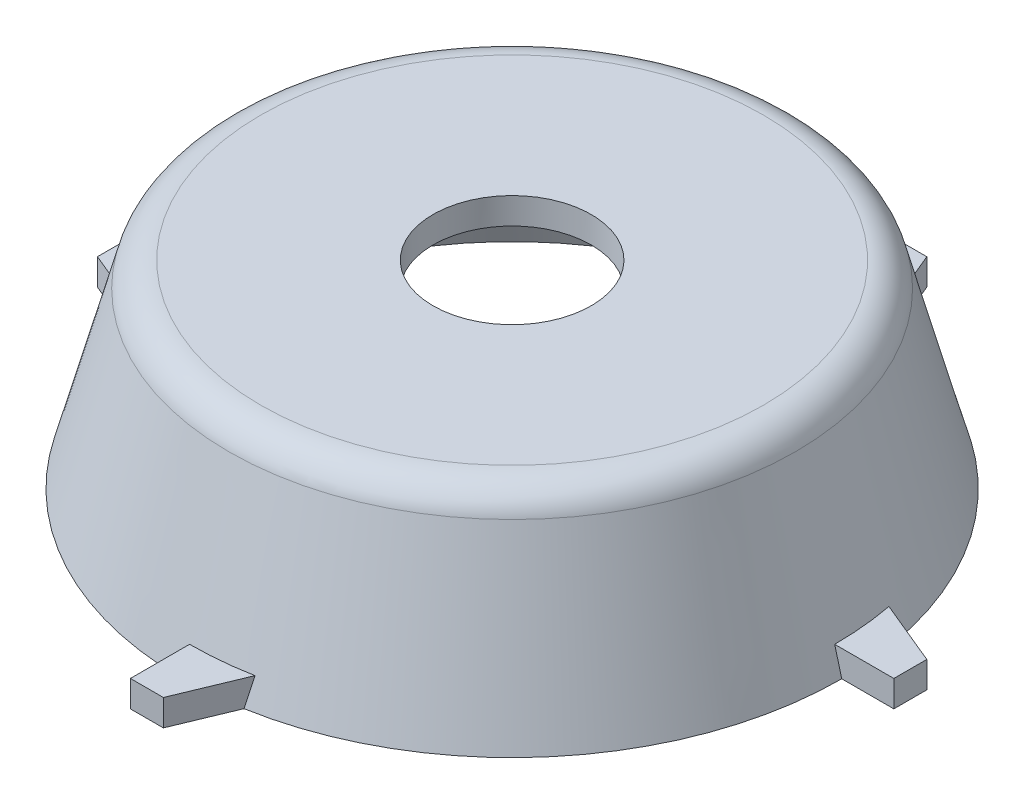
from build123d import *

# Parameters (mm, degrees)
CROQUIS3_W              = 50
CROQUIS3_H              = 30
VACIADO1_T              = -4
CORTAR_EXTRUIR1_REACH   = 78.811
CROQUIS7_R              = 12
REDONDEO1_R             = 5
SALIENTE_EXTRUIR1_DEPTH = 4
MATRIZC10_COUNT         = 4


with BuildPart() as part:
    # Croquis3 → Revolución1 (revolve)
    with BuildSketch(Plane(origin=(0, 0, 0), x_dir=(0, 0, -1), z_dir=(1, 0, 0)), mode=Mode.PRIVATE) as revoluci_n1_sk:
        with Locations((-25, 15)):
            Rectangle(CROQUIS3_W, CROQUIS3_H)
    revolve(revoluci_n1_sk.sketch.rotate(Axis((0, 0, 0), (0, 1, 0)), 180), axis=Axis((0, 0, 0), (0, 1, 0)))

    # Croquis6 → Cortar-Revolución1 (revolve, cut)
    with BuildSketch(Plane.XY, mode=Mode.PRIVATE) as cortar_revoluci_n1_sk:
        Polygon((-50, 30), (-50, 0), (-41.961524227, 30), align=None)
    revolve(cortar_revoluci_n1_sk.sketch.rotate(Axis((0, -970, 0), (0, 1, 0)), 180), axis=Axis((0, -970, 0), (0, 1, 0)), mode=Mode.SUBTRACT)

    # Vaciado1
    vaciado1_openings = [part.faces().sort_by_distance(p)[0] for p in [
        (0, 0, 0),
    ]]
    offset(amount=VACIADO1_T, openings=vaciado1_openings, kind=Kind.INTERSECTION)

    # Croquis7 → Cortar-Extruir1 (cut, up to next)
    with BuildSketch(Plane(origin=(0, 30, 0), x_dir=(1, 0, 0), z_dir=(0, 1, 0)), mode=Mode.PRIVATE) as cortar_extruir1_sk1:
        with Locations(Location((0, 0, 0), (0, 0, 270))):
            Circle(CROQUIS7_R)
    cortar_extruir1_tool1 = extrude(cortar_extruir1_sk1.sketch, amount=-CORTAR_EXTRUIR1_REACH, mode=Mode.PRIVATE) & part.part
    add(cortar_extruir1_tool1.solids().sort_by_distance((0, 30, 0))[0], mode=Mode.SUBTRACT)

    # Redondeo1
    redondeo1_edges = [part.edges().sort_by_distance(p)[0] for p in [
        (-41.961524227, 30, 0),
    ]]
    fillet(redondeo1_edges, radius=REDONDEO1_R)

    # Croquis8 → Saliente-Extruir1 (add)
    with BuildSketch(Plane(origin=(0, 0, 0), x_dir=(-1, 0, 0), z_dir=(0, -1, 0))):
        Polygon((0, 57.899543771), (5, 57.899543771), (10, 45.858895278), (0, 45.858895278), align=None)
    saliente_extruir1 = extrude(amount=-SALIENTE_EXTRUIR1_DEPTH)

    # Simetría1: Saliente-Extruir1 across plane
    add(saliente_extruir1.mirror(Plane(origin=(0, 4, -45.858895278), x_dir=(0, 0, 1), z_dir=(1, 0, 0))))

    # MatrizC10: Saliente-Extruir1 ×4 about axis
    matrizc10_axis = Axis((0, 0, 0), (0, 1, 0))
    for i in range(1, MATRIZC10_COUNT):
        add(saliente_extruir1.rotate(matrizc10_axis, i * 360 / MATRIZC10_COUNT))


solid = part.part
